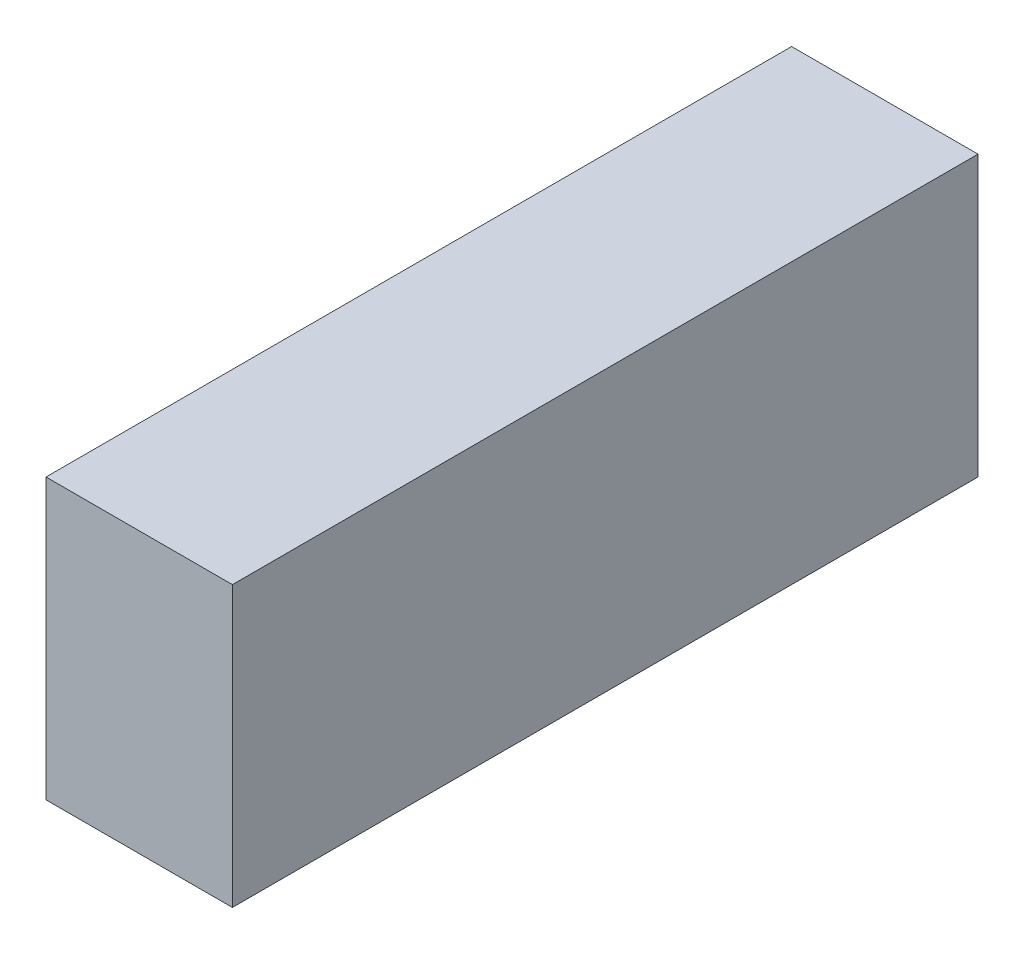
from build123d import *

# Parameters (mm, degrees)
CEK_TAZE_KAYIS_BAGLANTI_PABUCU_1_START = -40
SKETCH1_W                              = 10
SKETCH1_H                              = 15
CEK_TAZE_KAYIS_BAGLANTI_PABUCU_1_DEPTH = 40


with BuildPart() as part:
    # Sketch1 → CEK_taze_kayis_baglanti_pabucu_1 (new body)
    with BuildSketch(Plane.XY.offset(CEK_TAZE_KAYIS_BAGLANTI_PABUCU_1_START)):
        with Locations((7, 40.5)):
            Rectangle(SKETCH1_W, SKETCH1_H)
    extrude(amount=-CEK_TAZE_KAYIS_BAGLANTI_PABUCU_1_DEPTH)


solid = part.part
